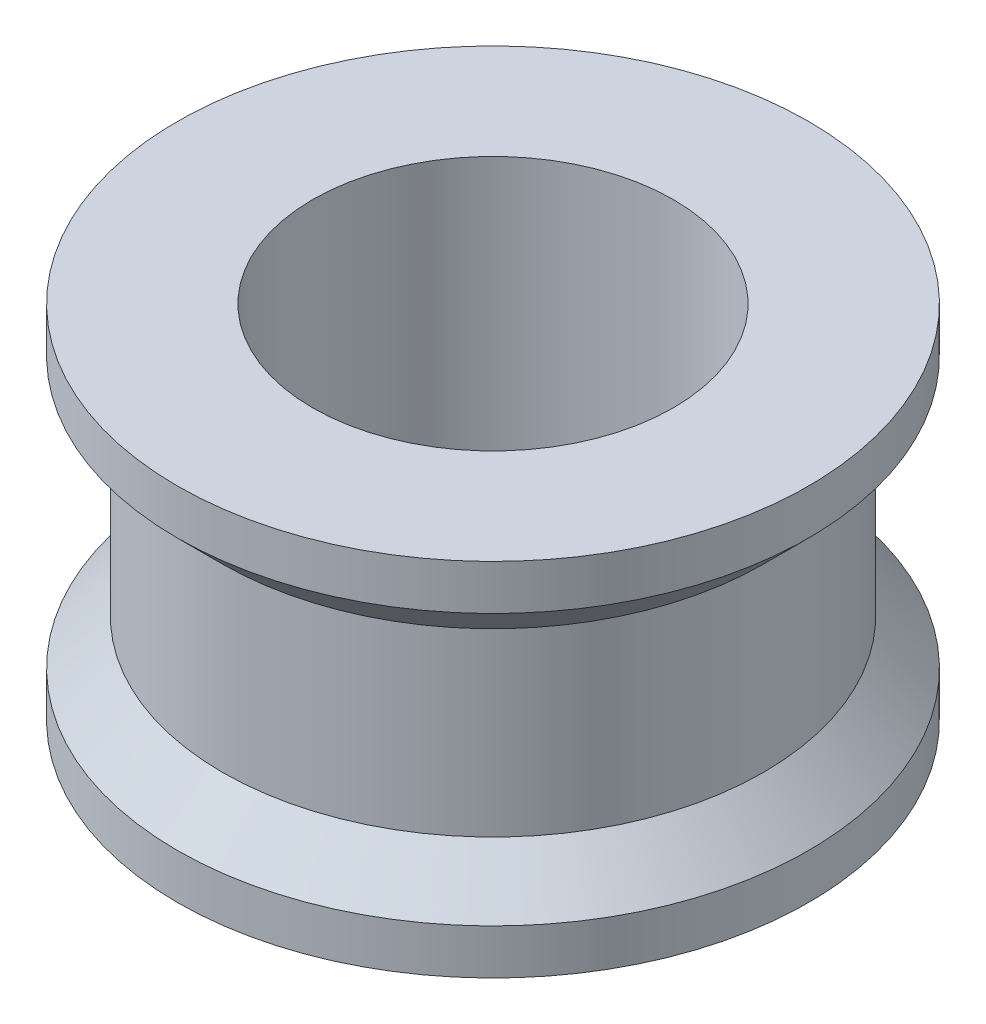
from build123d import *


with BuildPart() as part:
    # Sketch1 → Revolve1 (revolve)
    with BuildSketch(Plane.XY):
        Polygon((2, 0), (3.5, 0), (3.5, 0.5), (3, 1), (3, 3), (3.5, 3.5), (3.5, 4), (2, 4), align=None)
    revolve(axis=Axis((0, 45.491057376, 0), (0, -1, 0)))


solid = part.part
